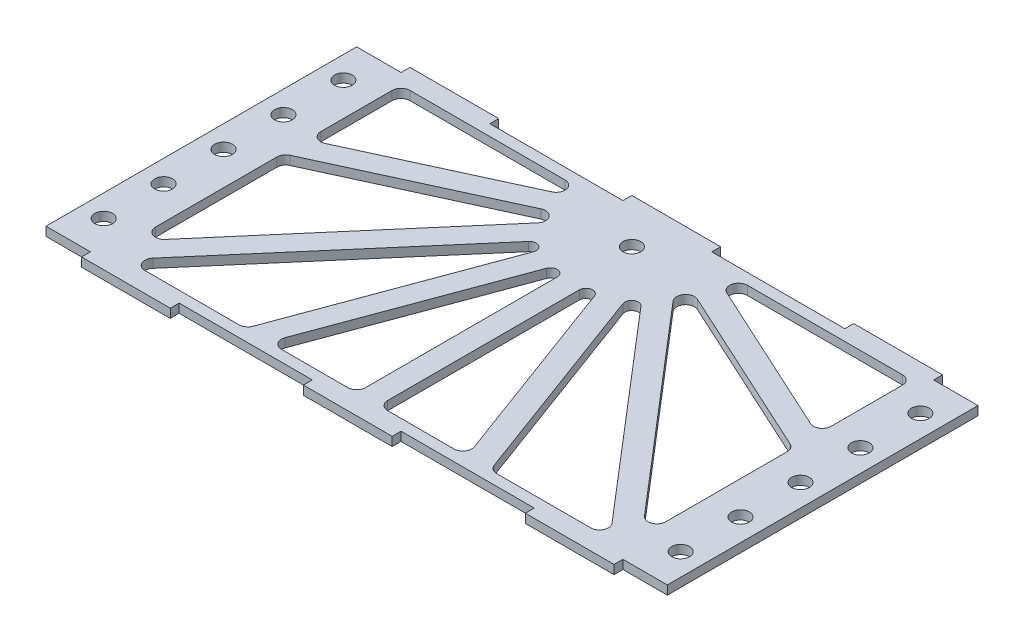
from build123d import *

# Parameters (mm, degrees)
SKETCH2_R           = 4
BOSS_EXTRUDE1_DEPTH = 4


with BuildPart() as part:
    # Sketch2 → Boss-Extrude1 (new body)
    with BuildSketch(Plane(origin=(0, 0, 0), x_dir=(1, 0, 0), z_dir=(0, 1, 0))):
        Polygon((-65.617598228, 28.706575469), (-65.617598228, -111.293424531), (-45.617598228, -111.293424531), (-45.617598228, -115.293424531), (-5.617598228, -115.293424531), (-5.617598228, -111.293424531), (54.382401772, -111.293424531), (54.382401772, -115.293424531), (94.382401772, -115.293424531), (94.382401772, -111.293424531), (154.382401772, -111.293424531), (154.382401772, -115.293424531), (194.382401772, -115.293424531), (194.382401772, -111.293424531), (214.382401772, -111.293424531), (214.382401772, 28.706575469), (194.382401772, 28.706575469), (194.382401772, 32.706575469), (154.382401772, 32.706575469), (154.382401772, 28.706575469), (94.382401772, 28.706575469), (94.382401772, 32.706575469), (54.382401772, 32.706575469), (54.382401772, 28.706575469), (-5.617598228, 28.706575469), (-5.617598228, 32.706575469), (-45.617598228, 32.706575469), (-45.617598228, 28.706575469), align=None)
        with Locations(Location((-55.617598228, 12.706575469, 0), (0, 0, 270))):
            Circle(SKETCH2_R, mode=Mode.SUBTRACT)
        with Locations(Location((-55.617598228, -14.293424531, 0), (0, 0, 270))):
            Circle(SKETCH2_R, mode=Mode.SUBTRACT)
        with Locations(Location((-55.617598228, -41.293424531, 0), (0, 0, 270))):
            Circle(SKETCH2_R, mode=Mode.SUBTRACT)
        with Locations(Location((-55.617598228, -68.293424531, 0), (0, 0, 270))):
            Circle(SKETCH2_R, mode=Mode.SUBTRACT)
        with Locations(Location((-55.617598228, -95.293424531, 0), (0, 0, 270))):
            Circle(SKETCH2_R, mode=Mode.SUBTRACT)
        with Locations(Location((204.382401772, -95.293424531, 0), (0, 0, 270))):
            Circle(SKETCH2_R, mode=Mode.SUBTRACT)
        with Locations(Location((204.382401772, -68.293424531, 0), (0, 0, 270))):
            Circle(SKETCH2_R, mode=Mode.SUBTRACT)
        with Locations(Location((204.382401772, -41.293424531, 0), (0, 0, 270))):
            Circle(SKETCH2_R, mode=Mode.SUBTRACT)
        with Locations(Location((204.382401772, -14.293424531, 0), (0, 0, 270))):
            Circle(SKETCH2_R, mode=Mode.SUBTRACT)
        with Locations(Location((204.382401772, 12.706575469, 0), (0, 0, 270))):
            Circle(SKETCH2_R, mode=Mode.SUBTRACT)
        with Locations(Location((74.382401772, 12.706575469, 0), (0, 0, 270))):
            Circle(SKETCH2_R, mode=Mode.SUBTRACT)
        with BuildLine():
            Line((39.126697, 6.98825761), (-38.288984409, -28.616858167))
            ThreePointArc((-38.288984409, -28.616858167), (-39.985501487, -30.092867561), (-40.617598228, -32.250928644))
            Line((-40.617598228, -32.250928644), (-40.617598228, -86.964107845))
            ThreePointArc((-40.617598228, -86.964107845), (-38.005383219, -90.715647904), (-33.580571819, -89.567273339))
            Line((-33.580571819, -89.567273339), (43.835109591, 0.751021639))
            ThreePointArc((43.835109591, 0.751021639), (43.990577731, 5.764161935), (39.126697, 6.98825761))
        make_face(mode=Mode.SUBTRACT)
        with BuildLine():
            Line((-40.617598228, 19.706575469), (-40.617598228, -12.438434514))
            ThreePointArc((-40.617598228, -12.438434514), (-38.775659311, -15.806337773), (-34.946212047, -16.072504992))
            Line((-34.946212047, -16.072504992), (34.946212047, 16.072504992))
            ThreePointArc((34.946212047, 16.072504992), (37.182272725, 20.562063076), (33.274825866, 23.706575469))
            Line((33.274825866, 23.706575469), (-36.617598228, 23.706575469))
            ThreePointArc((-36.617598228, 23.706575469), (-39.446025353, 22.535002594), (-40.617598228, 19.706575469))
        make_face(mode=Mode.SUBTRACT)
        with BuildLine():
            Line((-26.049612497, -106.293424531), (16.328011378, -106.293424531))
            ThreePointArc((16.328011378, -106.293424531), (18.613731131, -105.576027951), (20.079567117, -103.681167137))
            Line((20.079567117, -103.681167137), (54.190855271, -11.46637295))
            ThreePointArc((54.190855271, -11.46637295), (52.897576456, -7.839367943), (49.099418661, -8.473191875))
            Line((49.099418661, -8.473191875), (-29.086638907, -99.690259037))
            ThreePointArc((-29.086638907, -99.690259037), (-29.683664091, -103.964851769), (-26.049612497, -106.293424531))
        make_face(mode=Mode.SUBTRACT)
        with BuildLine():
            Line((79.382401772, -15.979265858), (79.382401772, -102.293424531))
            ThreePointArc((79.382401772, -102.293424531), (80.553974647, -105.121851656), (83.382401772, -106.293424531))
            Line((83.382401772, -106.293424531), (113.244754244, -106.293424531))
            ThreePointArc((113.244754244, -106.293424531), (116.527357664, -104.579144283), (116.996309982, -100.905681925))
            Line((116.996309982, -100.905681925), (85.196068576, -14.938458903))
            ThreePointArc((85.196068576, -14.938458903), (81.853724371, -13.026216551), (79.382401772, -15.979265858))
        make_face(mode=Mode.SUBTRACT)
        with BuildLine():
            Line((35.5200493, -106.293424531), (65.382401772, -106.293424531))
            ThreePointArc((65.382401772, -106.293424531), (68.210828897, -105.121851656), (69.382401772, -102.293424531))
            Line((69.382401772, -102.293424531), (69.382401772, -15.979265858))
            ThreePointArc((69.382401772, -15.979265858), (66.911079173, -13.026216551), (63.568734968, -14.938458903))
            Line((63.568734968, -14.938458903), (31.768493562, -100.905681925))
            ThreePointArc((31.768493562, -100.905681925), (32.23744588, -104.579144283), (35.5200493, -106.293424531))
        make_face(mode=Mode.SUBTRACT)
        with BuildLine():
            Line((187.053787953, -28.616858167), (109.638106544, 6.98825761))
            ThreePointArc((109.638106544, 6.98825761), (104.774225813, 5.764161935), (104.929693953, 0.751021639))
            Line((104.929693953, 0.751021639), (182.345375363, -89.567273339))
            ThreePointArc((182.345375363, -89.567273339), (186.770186763, -90.715647904), (189.382401772, -86.964107845))
            Line((189.382401772, -86.964107845), (189.382401772, -32.250928644))
            ThreePointArc((189.382401772, -32.250928644), (188.750305031, -30.092867561), (187.053787953, -28.616858167))
        make_face(mode=Mode.SUBTRACT)
        with BuildLine():
            Line((185.382401772, 23.706575469), (115.489977678, 23.706575469))
            ThreePointArc((115.489977678, 23.706575469), (111.582530819, 20.562063076), (113.818591497, 16.072504992))
            Line((113.818591497, 16.072504992), (183.711015591, -16.072504992))
            ThreePointArc((183.711015591, -16.072504992), (187.540462855, -15.806337773), (189.382401772, -12.438434514))
            Line((189.382401772, -12.438434514), (189.382401772, 19.706575469))
            ThreePointArc((189.382401772, 19.706575469), (188.210828897, 22.535002594), (185.382401772, 23.706575469))
        make_face(mode=Mode.SUBTRACT)
        with BuildLine():
            Line((94.573948273, -11.46637295), (128.685236427, -103.681167137))
            ThreePointArc((128.685236427, -103.681167137), (130.151072413, -105.576027951), (132.436792166, -106.293424531))
            Line((132.436792166, -106.293424531), (174.814416041, -106.293424531))
            ThreePointArc((174.814416041, -106.293424531), (178.448467635, -103.964851769), (177.851442451, -99.690259037))
            Line((177.851442451, -99.690259037), (99.665384883, -8.473191875))
            ThreePointArc((99.665384883, -8.473191875), (95.867227088, -7.839367943), (94.573948273, -11.46637295))
        make_face(mode=Mode.SUBTRACT)
    extrude(amount=BOSS_EXTRUDE1_DEPTH)


solid = part.part
